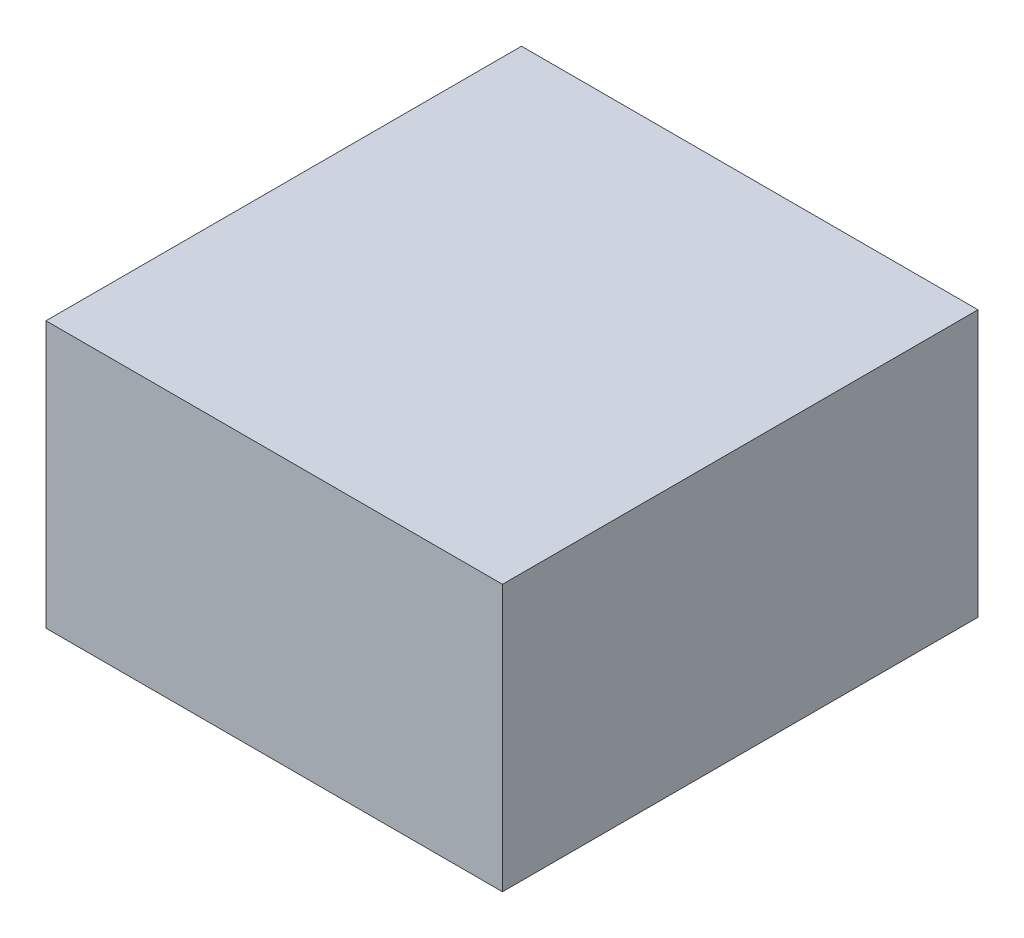
from build123d import *

# Parameters (mm, degrees)
CROQUIS1_W              = 48
CROQUIS1_H              = 28
SALIENTE_EXTRUIR1_DEPTH = 50
CROQUIS2_R              = 5
CORTAR_EXTRUIR1_DEPTH   = 10


with BuildPart() as part:
    # Croquis1 → Saliente-Extruir1 (new body)
    with BuildSketch(Plane.XY):
        Rectangle(CROQUIS1_W, CROQUIS1_H)
    extrude(amount=SALIENTE_EXTRUIR1_DEPTH)

    # Croquis2 → Cortar-Extruir1 (cut)
    with BuildSketch(Plane.XY):
        Circle(CROQUIS2_R)
    extrude(amount=CORTAR_EXTRUIR1_DEPTH, mode=Mode.SUBTRACT)


solid = part.part
